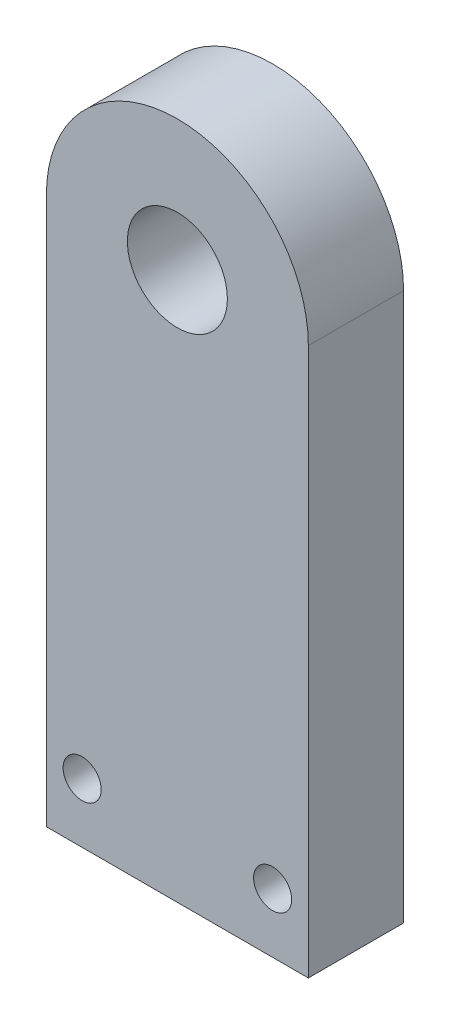
from build123d import *

# Parameters (mm, degrees)
RESSALTO_EXTRUS_O1_DEPTH                = 4
FURO_ROSCADO_DE_M21_D                   = 1.6
FURO_ROSCADO_PARA_CONDU_TE_DE_M4X0_71_D = 4.2


with BuildPart() as part:
    # Esboço1 → Ressalto-extrusão1 (new body)
    with BuildSketch(Plane.XY):
        with BuildLine():
            Line((-5.5, 0), (-5.5, -23))
            Line((-5.5, -23), (5.5, -23))
            Line((5.5, -23), (5.5, 0))
            ThreePointArc((5.5, 0), (0, 5.5), (-5.5, 0))
        make_face()
    extrude(amount=RESSALTO_EXTRUS_O1_DEPTH)

    # Furo roscado de M21 (through all)
    with Locations(Plane(origin=(-4, -20.5, 4), x_dir=(1, 0, 0), z_dir=(0, 0, 1))):
        with Locations((0, 0), (8, 0)):
            Hole(FURO_ROSCADO_DE_M21_D / 2)

    # Furo roscado para conduíte de M4x0.71 (through all)
    with Locations(Plane.XY.offset(4)):
        with Locations((0, 0)):
            Hole(FURO_ROSCADO_PARA_CONDU_TE_DE_M4X0_71_D / 2)


solid = part.part
